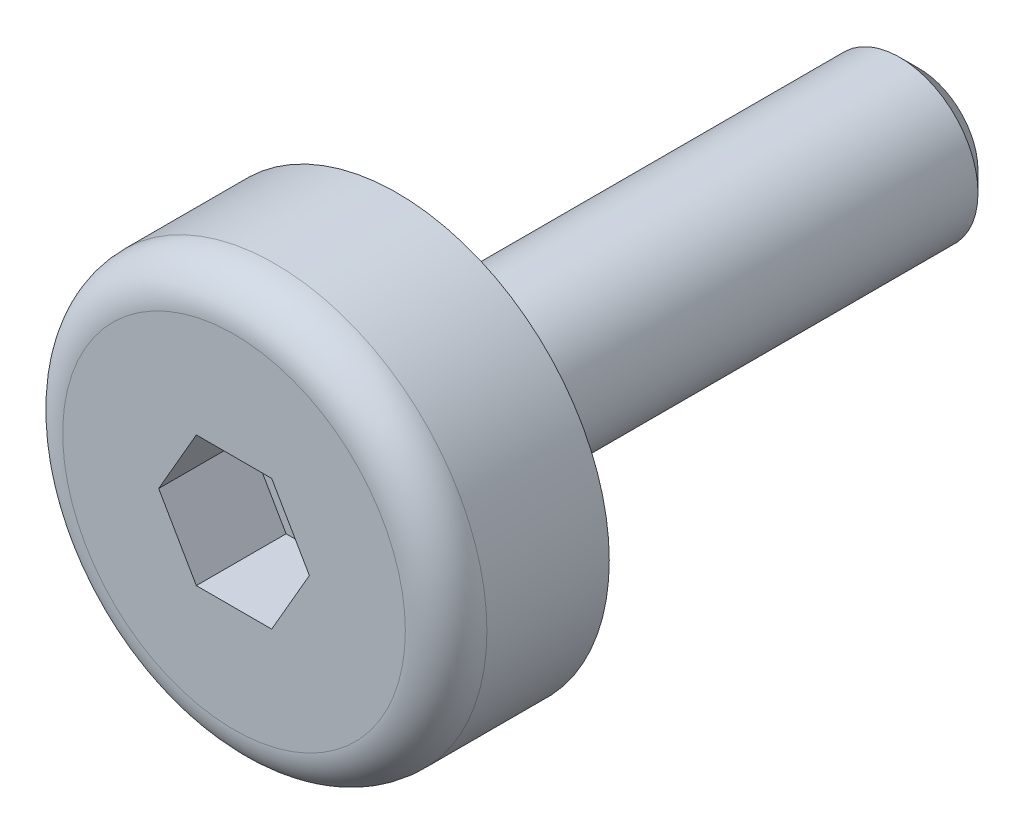
from build123d import *

# Parameters (mm, degrees)
SHANK_TIP_CHAMFER_SIZE = 0.3
PAN_HEAD_ROUND_R       = 0.625
HEX_DRIVE_CUT_DEPTH    = 1.375


with BuildPart() as part:
    # Screw Section → Screw Blank Revolve (revolve)
    with BuildSketch(Plane(origin=(0, 0, 0), x_dir=(1, 0, 0), z_dir=(0, 1, 0))):
        Polygon((0, 8), (1.2, 8), (1.2, 0), (3.25, 0), (3.25, -2.5), (0, -2.5), align=None)
    revolve(axis=Axis((0, 0, 10.123), (0, 0, -1)))

    # Shank Tip Chamfer
    shank_tip_chamfer_edges = [part.edges().sort_by_distance(p)[0] for p in [
        (-1.2, 0, -8),
    ]]
    chamfer(shank_tip_chamfer_edges, length=SHANK_TIP_CHAMFER_SIZE)

    # Pan Head Round
    pan_head_round_edges = [part.edges().sort_by_distance(p)[0] for p in [
        (-3.25, 0, 2.5),
    ]]
    fillet(pan_head_round_edges, radius=PAN_HEAD_ROUND_R)

    # Hex Drive Sketch → Hex Drive Cut (cut)
    with BuildSketch(Plane.XY.offset(2.5)):
        Polygon((1.154700538, 0), (0.577350269, 1), (-0.577350269, 1), (-1.154700538, 0), (-0.577350269, -1), (0.577350269, -1), align=None)
    extrude(amount=-HEX_DRIVE_CUT_DEPTH, mode=Mode.SUBTRACT)


solid = part.part
